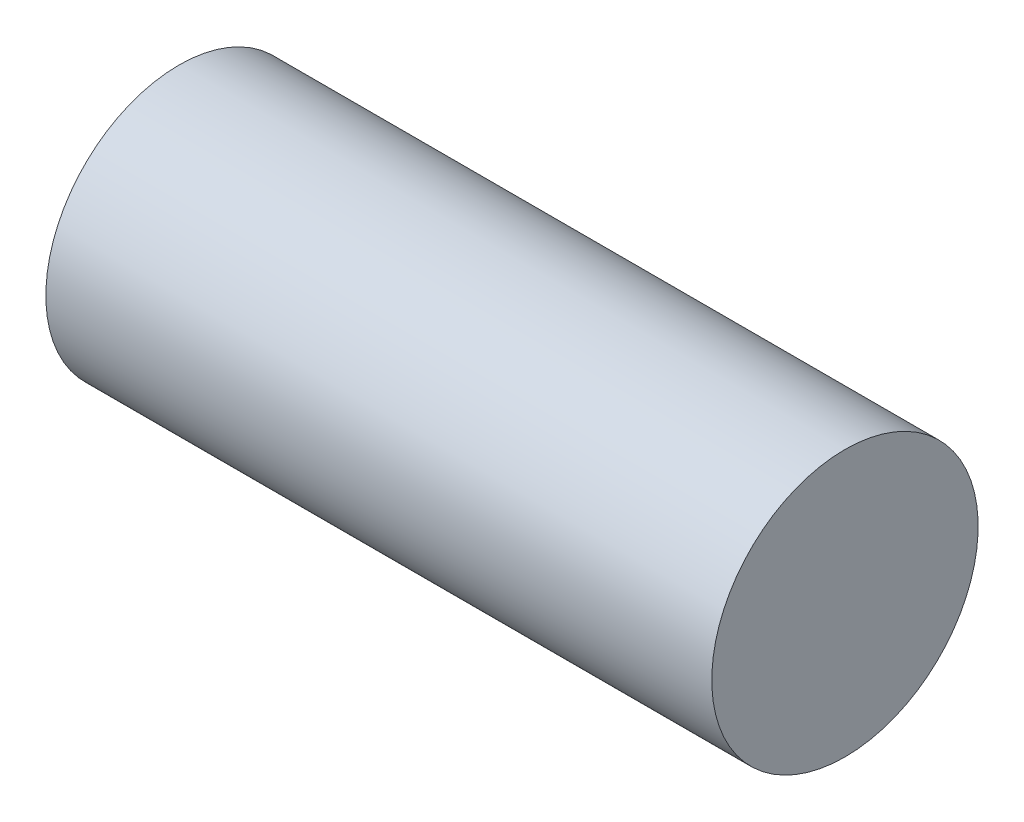
from build123d import *

# Parameters (mm, degrees)
SKETCH1_W      = 25
SKETCH1_H      = 5
REVOLVE1_ANGLE = 359.999999589


with BuildPart() as part:
    # Sketch1 → Revolve1 (revolve)
    with BuildSketch(Plane.XY):
        with Locations((12.5, 2.5)):
            Rectangle(SKETCH1_W, SKETCH1_H)
    revolve(axis=Axis((0, 0, 0), (1, 0, 0)), revolution_arc=REVOLVE1_ANGLE)


solid = part.part
